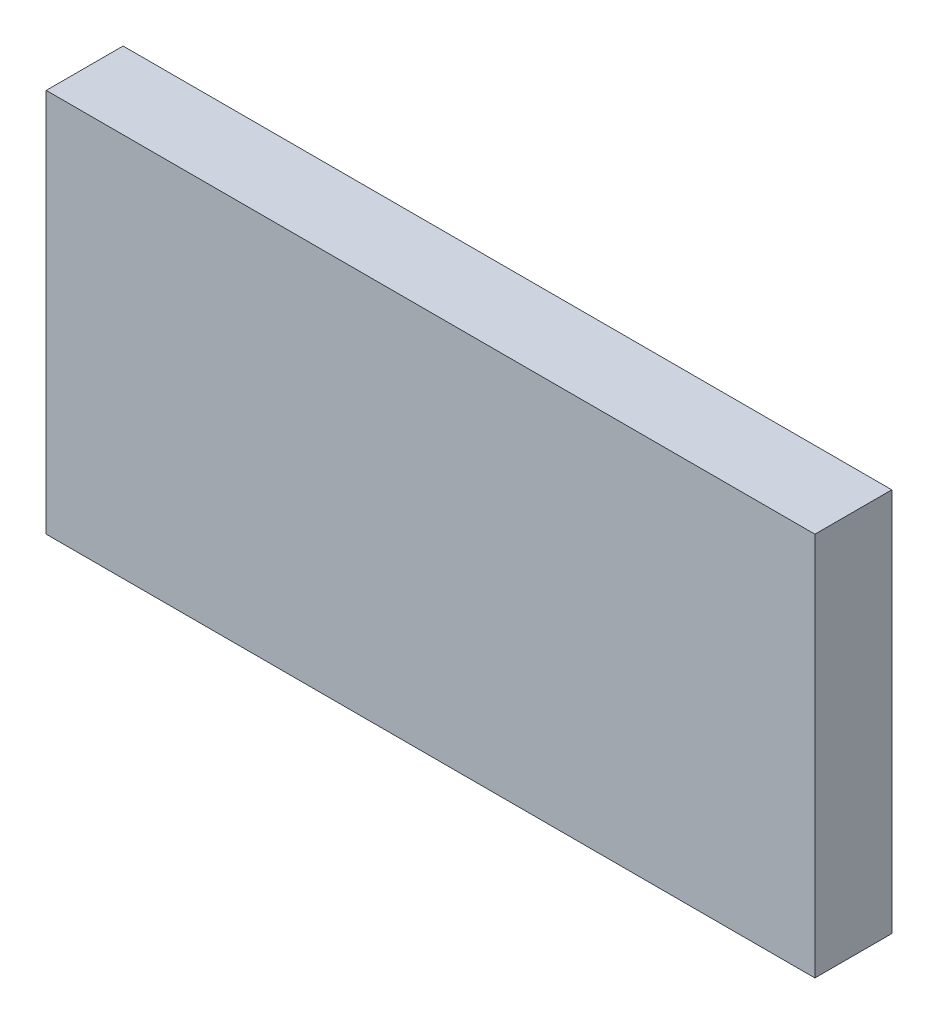
from build123d import *

# Parameters (mm, degrees)
SKETCH1_W           = 25.4
SKETCH1_H           = 12.7
BOSS_EXTRUDE1_DEPTH = 2.54


with BuildPart() as part:
    # Sketch1 → Boss-Extrude1 (new body)
    with BuildSketch(Plane.XY):
        with Locations((-12.7, 6.35)):
            Rectangle(SKETCH1_W, SKETCH1_H)
    extrude(amount=BOSS_EXTRUDE1_DEPTH)


solid = part.part
